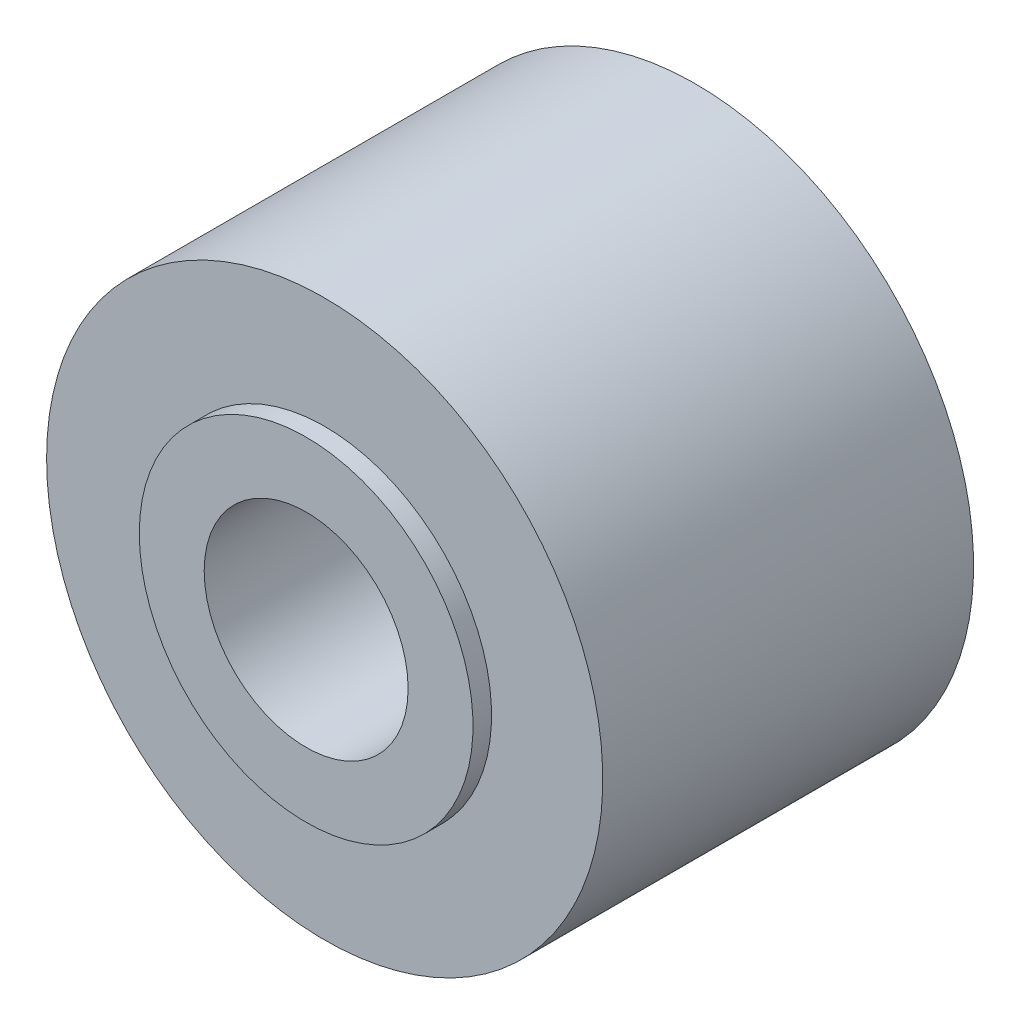
from build123d import *


with BuildPart() as part:
    # Sketch1 → Revolve1 (revolve)
    with BuildSketch(Plane(origin=(0, 0, 0), x_dir=(0, 0, -1), z_dir=(1, 0, 0)), mode=Mode.PRIVATE) as revolve1_sk:
        Polygon((0, -11), (0, -30), (-40, -30), (-40, -18), (-42, -18), (-42, -11), align=None)
    revolve(revolve1_sk.sketch.rotate(Axis((0, 0, -74.786862347), (0, 0, 1)), 270), axis=Axis((0, 0, -74.786862347), (0, 0, 1)))


solid = part.part
